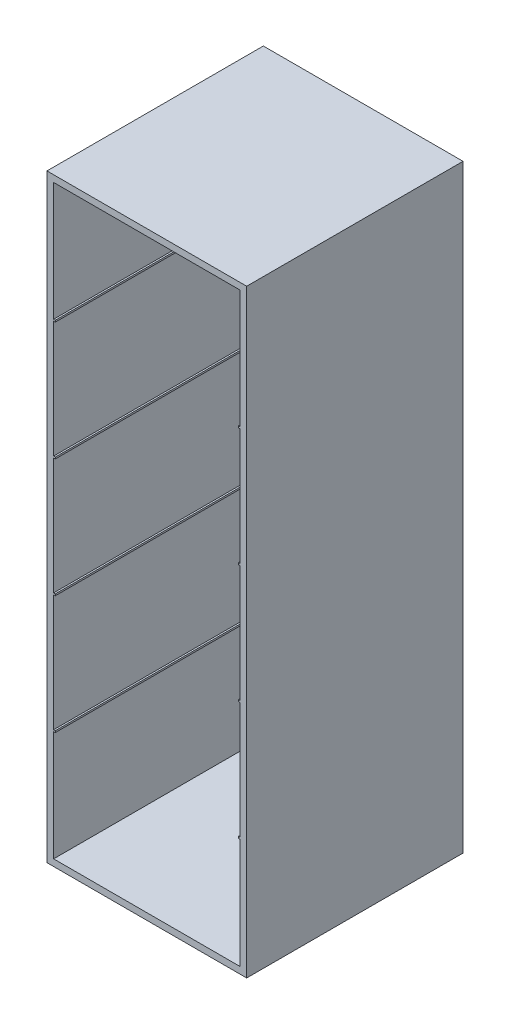
from build123d import *

# Parameters (mm, degrees)
SKETCH1_W           = 600
SKETCH1_H           = 1800
BOSS_EXTRUDE1_DEPTH = 650
SHELL1_T            = -20
BOSS_EXTRUDE2_REACH = 1152
SKETCH2_W           = 5
SKETCH2_H           = 5


with BuildPart() as part:
    # Sketch1 → Boss-Extrude1 (new body)
    with BuildSketch(Plane.XY):
        Rectangle(SKETCH1_W, SKETCH1_H)
    extrude(amount=BOSS_EXTRUDE1_DEPTH)

    # Shell1
    shell1_openings = [part.faces().sort_by_distance(p)[0] for p in [
        (0, 0, 650),
    ]]
    offset(amount=SHELL1_T, openings=shell1_openings, kind=Kind.INTERSECTION)

    # Sketch2 → Boss-Extrude2 (add, up to next)
    with BuildSketch(Plane.XY.offset(650), mode=Mode.PRIVATE) as boss_extrude2_sk1:
        with Locations((277.5, 521.5)):
            Rectangle(SKETCH2_W, SKETCH2_H)
    boss_extrude2_tool1 = extrude(boss_extrude2_sk1.sketch, amount=-BOSS_EXTRUDE2_REACH, mode=Mode.PRIVATE) - part.part
    # Sketch2 → Boss-Extrude2 (add, up to next)
    with BuildSketch(Plane.XY.offset(650), mode=Mode.PRIVATE) as boss_extrude2_sk2:
        with Locations((277.5, 165.5)):
            Rectangle(SKETCH2_W, SKETCH2_H)
    boss_extrude2_tool2 = extrude(boss_extrude2_sk2.sketch, amount=-BOSS_EXTRUDE2_REACH, mode=Mode.PRIVATE) - part.part
    # Sketch2 → Boss-Extrude2 (add, up to next)
    with BuildSketch(Plane.XY.offset(650), mode=Mode.PRIVATE) as boss_extrude2_sk3:
        with Locations((277.5, -190.5)):
            Rectangle(SKETCH2_W, SKETCH2_H)
    boss_extrude2_tool3 = extrude(boss_extrude2_sk3.sketch, amount=-BOSS_EXTRUDE2_REACH, mode=Mode.PRIVATE) - part.part
    # Sketch2 → Boss-Extrude2 (add, up to next)
    with BuildSketch(Plane.XY.offset(650), mode=Mode.PRIVATE) as boss_extrude2_sk4:
        with Locations((277.5, -546.5)):
            Rectangle(SKETCH2_W, SKETCH2_H)
    boss_extrude2_tool4 = extrude(boss_extrude2_sk4.sketch, amount=-BOSS_EXTRUDE2_REACH, mode=Mode.PRIVATE) - part.part
    boss_extrude2_1 = boss_extrude2_tool1.solids().sort_by_distance((277.5, 521.5, 650))[0]
    add(boss_extrude2_1)
    boss_extrude2_2 = boss_extrude2_tool2.solids().sort_by_distance((277.5, 165.5, 650))[0]
    add(boss_extrude2_2)
    boss_extrude2_3 = boss_extrude2_tool3.solids().sort_by_distance((277.5, -190.5, 650))[0]
    add(boss_extrude2_3)
    boss_extrude2_4 = boss_extrude2_tool4.solids().sort_by_distance((277.5, -546.5, 650))[0]
    add(boss_extrude2_4)
    boss_extrude2 = boss_extrude2_1 + boss_extrude2_2 + boss_extrude2_3 + boss_extrude2_4  # Boss-Extrude2 as one shape, for the pattern or mirror that repeats it

    # Mirror1: Boss-Extrude2 across plane
    add(boss_extrude2.mirror(Plane(origin=(0, 0, 0), x_dir=(0, 0, 1), z_dir=(1, 0, 0))))


solid = part.part
